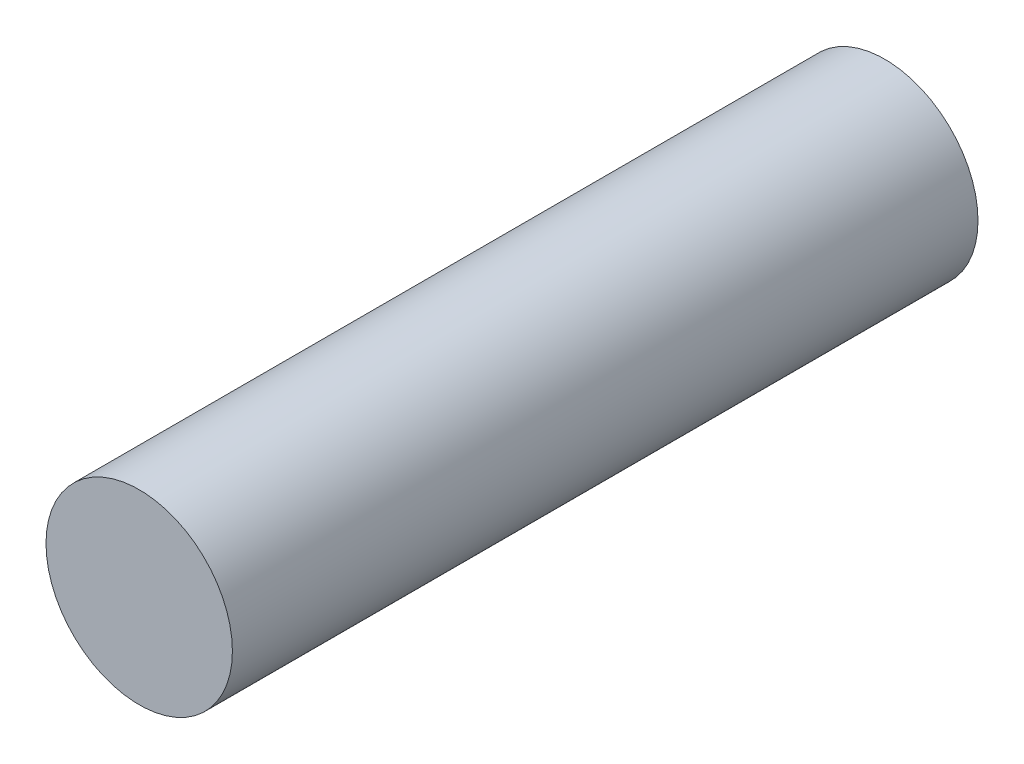
from build123d import *

# Parameters (mm, degrees)
SKETCH1_R           = 3.175
BOSS_EXTRUDE1_DEPTH = 25.4
SKETCH2_R           = 1.016
CUT_EXTRUDE1_DEPTH  = 5.08


with BuildPart() as part:
    # Sketch1 → Boss-Extrude1 (new body)
    with BuildSketch(Plane.XY):
        Circle(SKETCH1_R)
    extrude(amount=BOSS_EXTRUDE1_DEPTH)

    # Sketch2 → Cut-Extrude1 (cut)
    with BuildSketch(Plane(origin=(0, 0, 0), x_dir=(-1, 0, 0), z_dir=(0, 0, -1))):
        Circle(SKETCH2_R)
    extrude(amount=-CUT_EXTRUDE1_DEPTH, mode=Mode.SUBTRACT)


solid = part.part
